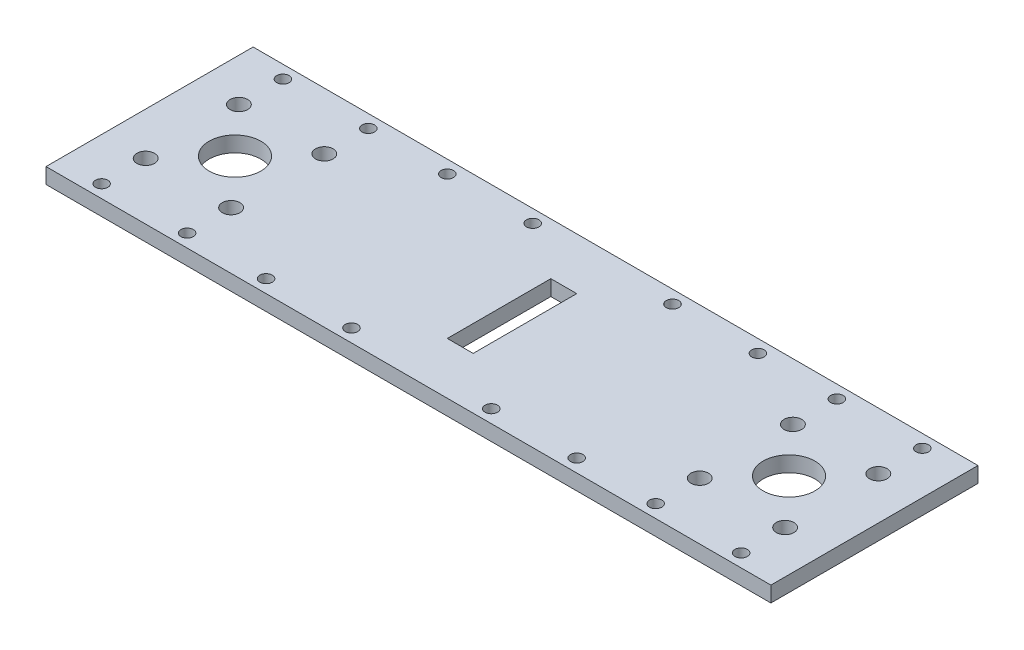
from build123d import *

# Parameters (mm, degrees)
SKETCH1_W           = 67
SKETCH1_H           = 40
SKETCH1_R           = 1.2
SKETCH1_W_2         = 5
SKETCH1_H_2         = 20
SKETCH1_W_3         = 36.5
SKETCH1_R_2         = 1.197563381
SKETCH1_R_3         = 1.7
SKETCH1_R_4         = 5
BOSS_EXTRUDE2_DEPTH = 3


with BuildPart() as part:
    # Sketch1 → Boss-Extrude2 (new body)
    # profile 1 of 3: a face of its own
    with BuildSketch(Plane(origin=(0, 0, 0), x_dir=(1, 0, 0), z_dir=(0, 1, 0))):
        Rectangle(SKETCH1_W, SKETCH1_H)
        with Locations(Location((-30, -17.5, 0), (0, 0, 270))):
            Circle(SKETCH1_R, mode=Mode.SUBTRACT)
        with Locations(Location((-13.5, -17.5, 0), (0, 0, 270))):
            Circle(SKETCH1_R, mode=Mode.SUBTRACT)
        with Locations(Location((13.5, -17.5, 0), (0, 0, 270))):
            Circle(SKETCH1_R, mode=Mode.SUBTRACT)
        with Locations(Location((30, -17.5, 0), (0, 0, 270))):
            Circle(SKETCH1_R, mode=Mode.SUBTRACT)
        Rectangle(SKETCH1_W_2, SKETCH1_H_2, mode=Mode.SUBTRACT)
        with Locations(Location((-30, 17.5, 0), (0, 0, 270))):
            Circle(SKETCH1_R, mode=Mode.SUBTRACT)
        with Locations(Location((-13.5, 17.5, 0), (0, 0, 270))):
            Circle(SKETCH1_R, mode=Mode.SUBTRACT)
        with Locations(Location((13.5, 17.5, 0), (0, 0, 270))):
            Circle(SKETCH1_R, mode=Mode.SUBTRACT)
        with Locations(Location((30, 17.5, 0), (0, 0, 270))):
            Circle(SKETCH1_R, mode=Mode.SUBTRACT)
    # profile 2 of 3: a face of its own
    with BuildSketch(Plane(origin=(0, 0, 0), x_dir=(1, 0, 0), z_dir=(0, 1, 0))):
        with Locations((-51.75, 0)):
            Rectangle(SKETCH1_W_3, SKETCH1_H)
        with Locations(Location((-61.75, -17.5, 0), (0, 0, 270))):
            Circle(SKETCH1_R_2, mode=Mode.SUBTRACT)
        with Locations(Location((-45.25, -17.5, 0), (0, 0, 270))):
            Circle(SKETCH1_R_2, mode=Mode.SUBTRACT)
        with Locations(Location((-61.75, -9, 0), (0, 0, 270))):
            Circle(SKETCH1_R_3, mode=Mode.SUBTRACT)
        with Locations(Location((-45.25, -9, 0), (0, 0, 270))):
            Circle(SKETCH1_R_3, mode=Mode.SUBTRACT)
        with Locations(Location((-53.5, 0, 0), (0, 0, 270))):
            Circle(SKETCH1_R_4, mode=Mode.SUBTRACT)
        with Locations(Location((-61.75, 9, 0), (0, 0, 270))):
            Circle(SKETCH1_R_3, mode=Mode.SUBTRACT)
        with Locations(Location((-45.25, 9, 0), (0, 0, 270))):
            Circle(SKETCH1_R_3, mode=Mode.SUBTRACT)
        with Locations(Location((-61.75, 17.5, 0), (0, 0, 270))):
            Circle(SKETCH1_R_2, mode=Mode.SUBTRACT)
        with Locations(Location((-45.25, 17.5, 0), (0, 0, 270))):
            Circle(SKETCH1_R_2, mode=Mode.SUBTRACT)
    # profile 3 of 3: a face of its own
    with BuildSketch(Plane(origin=(0, 0, 0), x_dir=(1, 0, 0), z_dir=(0, 1, 0))):
        with Locations((51.75, 0)):
            Rectangle(SKETCH1_W_3, SKETCH1_H)
        with Locations(Location((45.25, -17.5, 0), (0, 0, 270))):
            Circle(SKETCH1_R_2, mode=Mode.SUBTRACT)
        with Locations(Location((61.75, -17.5, 0), (0, 0, 270))):
            Circle(SKETCH1_R_2, mode=Mode.SUBTRACT)
        with Locations(Location((45.25, -9, 0), (0, 0, 270))):
            Circle(SKETCH1_R_3, mode=Mode.SUBTRACT)
        with Locations(Location((61.75, -9, 0), (0, 0, 270))):
            Circle(SKETCH1_R_3, mode=Mode.SUBTRACT)
        with Locations(Location((53.5, 0, 0), (0, 0, 270))):
            Circle(SKETCH1_R_4, mode=Mode.SUBTRACT)
        with Locations(Location((45.25, 9, 0), (0, 0, 270))):
            Circle(SKETCH1_R_3, mode=Mode.SUBTRACT)
        with Locations(Location((61.75, 9, 0), (0, 0, 270))):
            Circle(SKETCH1_R_3, mode=Mode.SUBTRACT)
        with Locations(Location((45.25, 17.5, 0), (0, 0, 270))):
            Circle(SKETCH1_R_2, mode=Mode.SUBTRACT)
        with Locations(Location((61.75, 17.5, 0), (0, 0, 270))):
            Circle(SKETCH1_R_2, mode=Mode.SUBTRACT)
    extrude(amount=BOSS_EXTRUDE2_DEPTH)


solid = part.part
